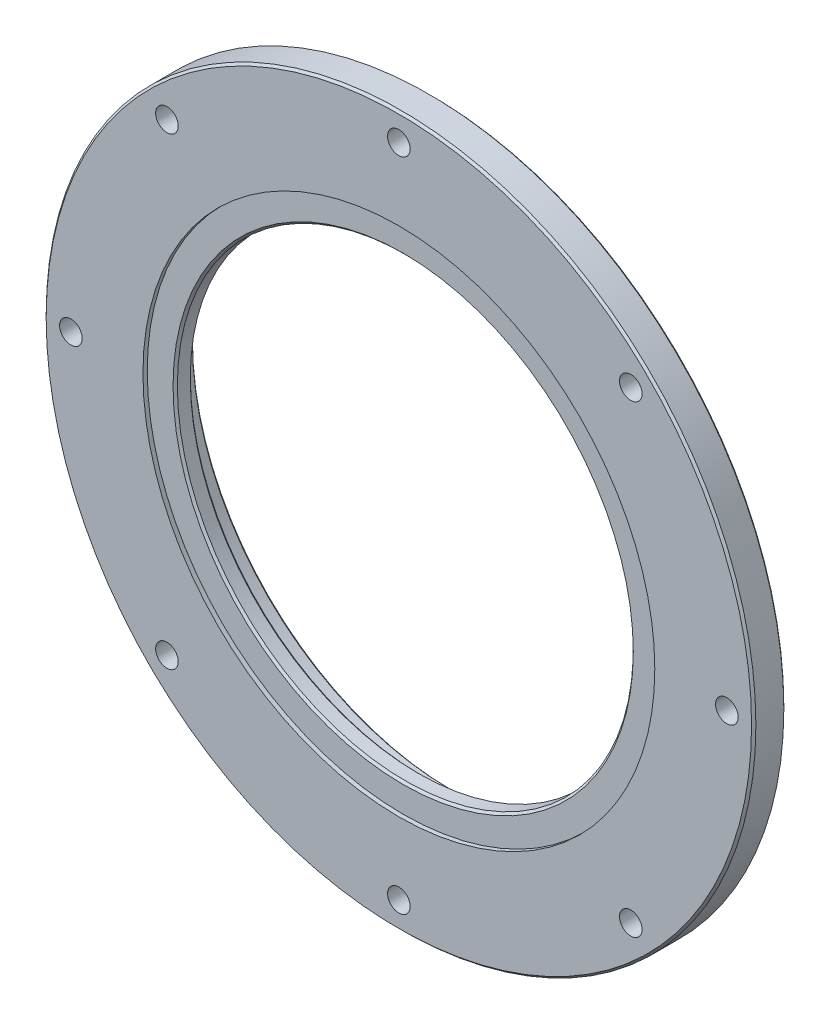
from build123d import *

# Parameters (mm, degrees)
SKETCH1_W                    = 165
SKETCH1_H                    = 15
SKETCH2_R                    = 140
BOSS_EXTRUDE1_DEPTH          = 10
F_10_5_10_5_DIAMETER_HOLE1_D = 10.5
CHAMFER1_SIZE                = 1


with BuildPart() as part:
    # Sketch1 → Revolve1 (revolve)
    with BuildSketch(Plane.XZ, mode=Mode.PRIVATE) as revolve1_sk:
        with Locations((82.5, -7.5)):
            Rectangle(SKETCH1_W, SKETCH1_H)
    revolve(revolve1_sk.sketch.rotate(Axis((0, 0, 0), (0, 0, -1)), 180), axis=Axis((0, 0, 0), (0, 0, -1)))

    # Sketch2 → Boss-Extrude1 (add)
    with BuildSketch(Plane(origin=(0, 0, -15), x_dir=(-1, 0, 0), z_dir=(0, 0, -1))):
        Circle(SKETCH2_R)
    extrude(amount=BOSS_EXTRUDE1_DEPTH)

    # Sketch3 → Cut-Revolve1 (revolve, cut)
    with BuildSketch(Plane.XZ, mode=Mode.PRIVATE) as cut_revolve1_sk:
        Polygon((119, 0), (0, 0), (0, -25), (120, -25), (120, -10), (106, -10), (106, -2), (119, -2), align=None)
    revolve(cut_revolve1_sk.sketch.rotate(Axis((0, 0, 0), (0, 0, -1)), 180), axis=Axis((0, 0, 0), (0, 0, -1)), mode=Mode.SUBTRACT)

    # Sketch4 → Cut-Revolve2 (revolve, cut)
    with BuildSketch(Plane(origin=(0, -49.748846207, 0), x_dir=(1, 0, 0), z_dir=(0, 1, 0)), mode=Mode.PRIVATE) as cut_revolve2_sk:
        Polygon((-116.780839226, 25), (-120.104339226, 25), (-120.104339226, 10), (-116.780839226, 11.996960267), (-116.780839226, 15), align=None)
    revolve(cut_revolve2_sk.sketch.rotate(Axis((-120.104339226, -49.748846207, -25), (0, 0, 1)), 180), axis=Axis((-120.104339226, -49.748846207, -25), (0, 0, 1)), mode=Mode.SUBTRACT)

    # Sketch5 → Cut-Revolve3 (revolve, cut)
    with BuildSketch(Plane(origin=(0, -120.104339226, 0), x_dir=(1, 0, 0), z_dir=(0, 1, 0)), mode=Mode.PRIVATE) as cut_revolve3_sk:
        Polygon((-46.425346207, 25), (-49.748846207, 25), (-49.748846207, 10), (-46.425346207, 11.996960267), (-46.425346207, 15), align=None)
    revolve(cut_revolve3_sk.sketch.rotate(Axis((-49.748846207, -120.104339226, -25), (0, 0, 1)), 180), axis=Axis((-49.748846207, -120.104339226, -25), (0, 0, 1)), mode=Mode.SUBTRACT)

    # Sketch6 → Cut-Revolve4 (revolve, cut)
    with BuildSketch(Plane(origin=(0, -120.104339226, 0), x_dir=(1, 0, 0), z_dir=(0, 1, 0)), mode=Mode.PRIVATE) as cut_revolve4_sk:
        Polygon((53.072346207, 25), (49.748846207, 25), (49.748846207, 10), (53.072346207, 11.996960267), (53.072346207, 15), align=None)
    revolve(cut_revolve4_sk.sketch.rotate(Axis((49.748846207, -120.104339226, -25), (0, 0, 1)), 180), axis=Axis((49.748846207, -120.104339226, -25), (0, 0, 1)), mode=Mode.SUBTRACT)

    # Sketch7 → Cut-Revolve5 (revolve, cut)
    with BuildSketch(Plane(origin=(0, -49.748846207, 0), x_dir=(1, 0, 0), z_dir=(0, 1, 0)), mode=Mode.PRIVATE) as cut_revolve5_sk:
        Polygon((123.427839226, 25), (120.104339226, 25), (120.104339226, 10), (123.427839226, 11.996960267), (123.427839226, 15), align=None)
    revolve(cut_revolve5_sk.sketch.rotate(Axis((120.104339226, -49.748846207, -25), (0, 0, 1)), 180), axis=Axis((120.104339226, -49.748846207, -25), (0, 0, 1)), mode=Mode.SUBTRACT)

    # Sketch8 → Cut-Revolve6 (revolve, cut)
    with BuildSketch(Plane(origin=(0, 49.748846207, 0), x_dir=(1, 0, 0), z_dir=(0, 1, 0)), mode=Mode.PRIVATE) as cut_revolve6_sk:
        Polygon((123.427839226, 25), (120.104339226, 25), (120.104339226, 10), (123.427839226, 11.996960267), (123.427839226, 15), align=None)
    revolve(cut_revolve6_sk.sketch.rotate(Axis((120.104339226, 49.748846207, -25), (0, 0, 1)), 180), axis=Axis((120.104339226, 49.748846207, -25), (0, 0, 1)), mode=Mode.SUBTRACT)

    # Sketch9 → Cut-Revolve7 (revolve, cut)
    with BuildSketch(Plane(origin=(0, 120.104339226, 0), x_dir=(1, 0, 0), z_dir=(0, 1, 0)), mode=Mode.PRIVATE) as cut_revolve7_sk:
        Polygon((53.072346207, 25), (49.748846207, 25), (49.748846207, 10), (53.072346207, 11.996960267), (53.072346207, 15), align=None)
    revolve(cut_revolve7_sk.sketch.rotate(Axis((49.748846207, 120.104339226, -25), (0, 0, 1)), 180), axis=Axis((49.748846207, 120.104339226, -25), (0, 0, 1)), mode=Mode.SUBTRACT)

    # Sketch10 → Cut-Revolve8 (revolve, cut)
    with BuildSketch(Plane(origin=(0, 120.104339226, 0), x_dir=(1, 0, 0), z_dir=(0, 1, 0)), mode=Mode.PRIVATE) as cut_revolve8_sk:
        Polygon((-46.425346207, 25), (-49.748846207, 25), (-49.748846207, 10), (-46.425346207, 11.996960267), (-46.425346207, 15), align=None)
    revolve(cut_revolve8_sk.sketch.rotate(Axis((-49.748846207, 120.104339226, -25), (0, 0, 1)), 180), axis=Axis((-49.748846207, 120.104339226, -25), (0, 0, 1)), mode=Mode.SUBTRACT)

    # Sketch11 → Cut-Revolve9 (revolve, cut)
    with BuildSketch(Plane(origin=(0, 49.748846207, 0), x_dir=(1, 0, 0), z_dir=(0, 1, 0)), mode=Mode.PRIVATE) as cut_revolve9_sk:
        Polygon((-116.780839226, 25), (-120.104339226, 25), (-120.104339226, 10), (-116.780839226, 11.996960267), (-116.780839226, 15), align=None)
    revolve(cut_revolve9_sk.sketch.rotate(Axis((-120.104339226, 49.748846207, -25), (0, 0, 1)), 180), axis=Axis((-120.104339226, 49.748846207, -25), (0, 0, 1)), mode=Mode.SUBTRACT)

    # Ø10.5 (10.5) Diameter Hole1 (through all)
    with Locations(Plane(origin=(0, 0, -15), x_dir=(-1, 0, 0), z_dir=(0, 0, -1))):
        with Locations((152.5, 0), (107.833784131, -107.833784131), (0, -152.5), (-107.833784131, -107.833784131), (-152.5, 0), (-107.833784131, 107.833784131), (0, 152.5), (107.833784131, 107.833784131)):
            Hole(F_10_5_10_5_DIAMETER_HOLE1_D / 2)

    # Chamfer1
    chamfer1_edges = [part.edges().sort_by_distance(p)[0] for p in [
        (140, 0, -25),
        (120, 0, -25),
        (106, 0, -10),
        (106, 0, -2),
        (165, 0, -15),
        (165, 0, 0),
    ]]
    chamfer(chamfer1_edges, length=CHAMFER1_SIZE)


solid = part.part
